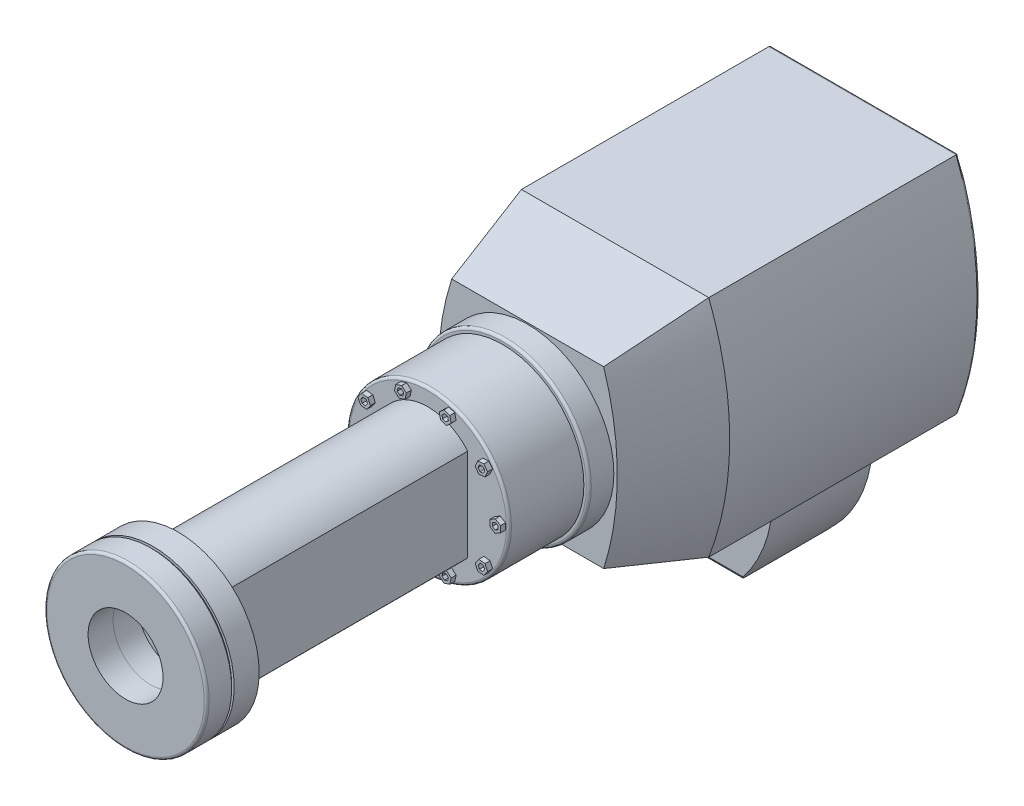
from build123d import *

# Parameters (mm, degrees)
BOSS_EXTRUDE1_DEPTH  = 100
SKETCH4_R            = 34.5
BOSS_EXTRUDE2_DEPTH  = 10
SKETCH5_R            = 32.5
BOSS_EXTRUDE3_DEPTH  = 30
BOSS_EXTRUDE4_DEPTH  = 2
CIRPATTERN1_COUNT    = 10
BOSS_EXTRUDE5_DEPTH  = 100
SKETCH8_R            = 32.5
BOSS_EXTRUDE6_DEPTH  = 10
SKETCH9_R            = 31.5
BOSS_EXTRUDE7_DEPTH  = 1
SKETCH10_R           = 32.5
BOSS_EXTRUDE8_DEPTH  = 10
SKETCH11_R           = 42.5
BOSS_EXTRUDE9_DEPTH  = 10.5
BOSS_EXTRUDE10_DEPTH = 35
BOSS_EXTRUDE11_DEPTH = 20
CUT_EXTRUDE1_DEPTH   = 314.700892617
FILLET1_R            = 1
FILLET2_R            = 1
SKETCH15_R           = 15
CUT_EXTRUDE2_DEPTH   = 20
SKETCH16_R           = 15
CUT_EXTRUDE3_DEPTH   = 20


with BuildPart() as part:
    # Sketch1 → Boss-Extrude1 (new body)
    with BuildSketch(Plane.XY):
        with BuildLine():
            Line((-37.5, 45), (37.5, 45))
            ThreePointArc((37.5, 45), (45.880962103, 0), (37.5, -45))
            Line((37.5, -45), (-37.5, -45))
            ThreePointArc((-37.5, -45), (-45.880962103, 0), (-37.5, 45))
        make_face()
    extrude(amount=BOSS_EXTRUDE1_DEPTH)

    # Sketch3 for Loft1 → Loft1 section 0
    with BuildSketch(Plane.XY.offset(135)):
        with BuildLine():
            Line((30.425473604, 35), (-30.425473604, 35))
            # circular arc as an exact rational Bezier (weights 1, cos(half-angle), 1)
            Bezier((-30.425473604, 35), (-41.608142487, 0), (-30.425473604, -35), weights=[1, 0.95256097, 1])
            Line((-30.425473604, -35), (30.425473604, -35))
            Bezier((30.425473604, -35), (41.608142487, 0), (30.425473604, 35), weights=[1, 0.95256097, 1])
        make_face()
    # Sketch2 for Loft1 → Loft1 section 1
    with BuildSketch(Plane.XY.offset(100)):
        with BuildLine():
            Line((37.5, 45), (-37.5, 45))
            Bezier((-37.5, 45), (-54.864231746, 0), (-37.5, -45), weights=[1, 0.932952303, 1])
            Line((-37.5, -45), (37.5, -45))
            Bezier((37.5, -45), (54.864231746, 0), (37.5, 45), weights=[1, 0.932952303, 1])
        make_face()
    loft()

    # Sketch4 → Boss-Extrude2 (add)
    with BuildSketch(Plane.XY.offset(135)):
        Circle(SKETCH4_R)
    extrude(amount=BOSS_EXTRUDE2_DEPTH)

    # Sketch5 → Boss-Extrude3 (add)
    with BuildSketch(Plane.XY.offset(145)):
        Circle(SKETCH5_R)
    extrude(amount=BOSS_EXTRUDE3_DEPTH)

    # Sketch6 → Boss-Extrude4 (add)
    with BuildSketch(Plane.XY.offset(175)):
        Polygon((29, 2.5), (26.834936491, 1.25), (26.834936491, -1.25), (29, -2.5), (31.165063509, -1.25), (31.165063509, 1.25), align=None)
        Polygon((29, 1.345299462), (27.834936491, 0.672649731), (27.834936491, -0.672649731), (29, -1.345299462), (30.165063509, -0.672649731), (30.165063509, 0.672649731), align=None, mode=Mode.SUBTRACT)
    boss_extrude4 = extrude(amount=BOSS_EXTRUDE4_DEPTH)

    # CirPattern1: Boss-Extrude4 ×10 about axis
    cirpattern1_axis = Axis((0, 0, 0), (0, 0, 1))
    for i in range(1, CIRPATTERN1_COUNT):
        add(boss_extrude4.rotate(cirpattern1_axis, i * 360 / CIRPATTERN1_COUNT))

    # Sketch7 → Boss-Extrude5 (add)
    with BuildSketch(Plane.XY.offset(175)):
        with BuildLine():
            Line((16, -18.5), (16, 18.5))
            ThreePointArc((16, 18.5), (0, 25.898529491), (-16, 18.5))
            Line((-16, 18.5), (-16, -18.5))
            ThreePointArc((-16, -18.5), (0, -25.898529491), (16, -18.5))
        make_face()
    extrude(amount=BOSS_EXTRUDE5_DEPTH)

    # Sketch8 → Boss-Extrude6 (add)
    with BuildSketch(Plane.XY.offset(275)):
        Circle(SKETCH8_R)
    extrude(amount=BOSS_EXTRUDE6_DEPTH)

    # Sketch9 → Boss-Extrude7 (add)
    with BuildSketch(Plane.XY.offset(285)):
        Circle(SKETCH9_R)
    extrude(amount=BOSS_EXTRUDE7_DEPTH)

    # Sketch11 → Boss-Extrude9 (add, symmetric)
    with BuildSketch(Plane(origin=(-37.5, 0, 0), x_dir=(0, 0, -1), z_dir=(1, 0, 0))):
        with Locations((-50, -45)):
            Circle(SKETCH11_R)
    extrude(amount=BOSS_EXTRUDE9_DEPTH, both=True)

    # Sketch12 → Boss-Extrude10 (add)
    with BuildSketch(Plane(origin=(-27, 0, 0), x_dir=(0, 0, -1), z_dir=(1, 0, 0))):
        with BuildLine():
            Line((-70, -45), (-70, -75))
            ThreePointArc((-70, -75), (-50, -85.128852225), (-30, -75))
            Line((-30, -75), (-30, -45))
            Line((-30, -45), (-70, -45))
        make_face()
    extrude(amount=BOSS_EXTRUDE10_DEPTH)

    # Sketch13 → Boss-Extrude11 (add, symmetric)
    with BuildSketch(Plane.XY.offset(50)):
        with BuildLine():
            Line((8, -45), (8, -87))
            ThreePointArc((8, -87), (25.421855105, -68.929675658), (33, -45))
            Line((33, -45), (8, -45))
        make_face()
    extrude(amount=BOSS_EXTRUDE11_DEPTH, both=True)

    # Sketch14 → Cut-Extrude1 (cut, through all)
    with BuildSketch(Plane.ZY.offset(-8)):
        with BuildLine():
            Line((70, -87), (70, -75))
            ThreePointArc((70, -75), (50, -85.128852225), (30, -75))
            Line((30, -75), (30, -87))
            Line((30, -87), (70, -87))
        make_face()
    extrude(amount=-CUT_EXTRUDE1_DEPTH, mode=Mode.SUBTRACT)

    # Fillet1
    fillet1_edges = [part.edges().sort_by_distance(p)[0] for p in [
        (-34.5, 0, 145),
        (-32.5, 0, 175),
        (-48, -45, 92.5),
        (-27, -87.5, 50),
        (0, -45, 0),
        (-45.880962103, 0, 0),
        (0, 45, 0),
        (45.880962103, 0, 0),
    ]]
    fillet(fillet1_edges, radius=FILLET1_R)


with BuildPart() as body_2:
    # Sketch10 → Boss-Extrude8 (new body)
    with BuildSketch(Plane.XY.offset(286)):
        Circle(SKETCH10_R)
    extrude(amount=BOSS_EXTRUDE8_DEPTH)

    # Fillet2
    fillet2_edges = [body_2.edges().sort_by_distance(p)[0] for p in [
        (-32.5, 0, 296),
    ]]
    fillet(fillet2_edges, radius=FILLET2_R)


with BuildPart() as cut_extrude2_tool:
    # Sketch15 → Cut-Extrude2 (new body)
    with BuildSketch(Plane.XY.offset(296)):
        Circle(SKETCH15_R)
    extrude(amount=-CUT_EXTRUDE2_DEPTH)


with BuildPart() as part_1:
    add(part.part)

    # Cut-Extrude2: cut by cut_extrude2_tool
    add(cut_extrude2_tool.part, mode=Mode.SUBTRACT)

    # Sketch16 → Cut-Extrude3 (cut)
    with BuildSketch(Plane.ZY.offset(48)):
        with Locations((50, -45)):
            Circle(SKETCH16_R)
    extrude(amount=-CUT_EXTRUDE3_DEPTH, mode=Mode.SUBTRACT)


with BuildPart() as body_2_1:
    add(body_2.part)

    # Cut-Extrude2: cut by cut_extrude2_tool
    add(cut_extrude2_tool.part, mode=Mode.SUBTRACT)


solid = Compound([part_1.part, body_2_1.part])
